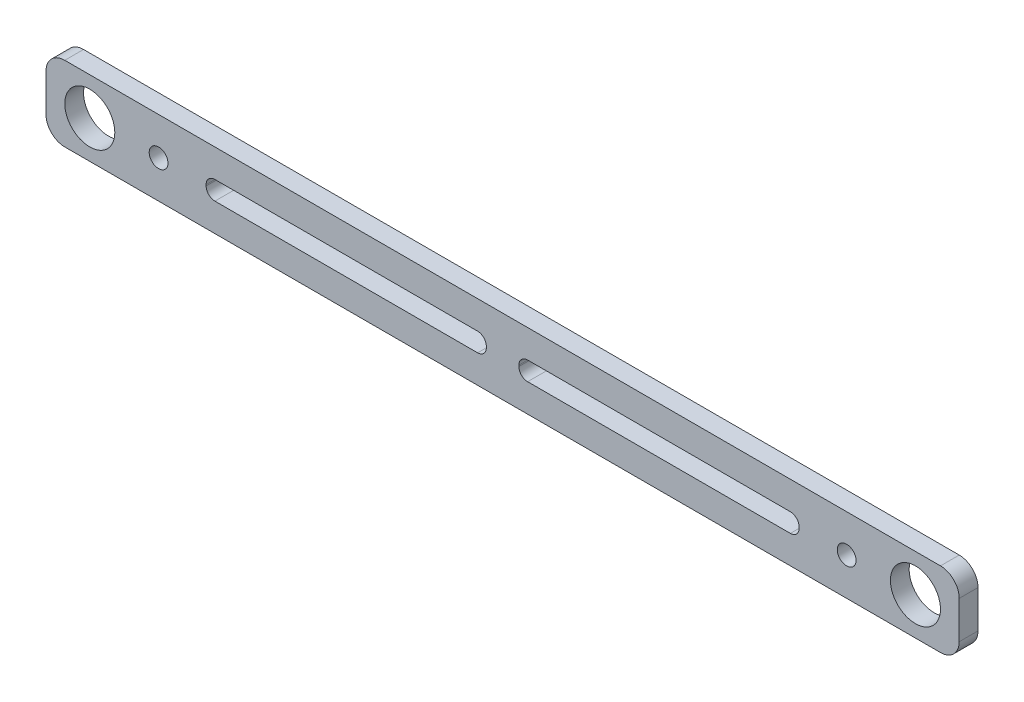
from build123d import *

# Parameters (mm, degrees)
SKETCH1_R           = 4
SKETCH1_R_2         = 1.5
BOSS_EXTRUDE1_DEPTH = 3


with BuildPart() as part:
    # Sketch1 → Boss-Extrude1 (new body)
    with BuildSketch(Plane.XY):
        with BuildLine():
            Line((-70, 6), (70, 6))
            ThreePointArc((70, 6), (72.121320344, 5.121320344), (73, 3))
            Line((73, 3), (73, -3))
            ThreePointArc((73, -3), (72.121320344, -5.121320344), (70, -6))
            Line((70, -6), (-70, -6))
            ThreePointArc((-70, -6), (-72.121320344, -5.121320344), (-73, -3))
            Line((-73, -3), (-73, 3))
            ThreePointArc((-73, 3), (-72.121320344, 5.121320344), (-70, 6))
        make_face()
        with Locations((-66, 0)):
            Circle(SKETCH1_R, mode=Mode.SUBTRACT)
        with Locations((66, 0)):
            Circle(SKETCH1_R, mode=Mode.SUBTRACT)
        with Locations((-55, 0)):
            Circle(SKETCH1_R_2, mode=Mode.SUBTRACT)
        with Locations((55, 0)):
            Circle(SKETCH1_R_2, mode=Mode.SUBTRACT)
        with BuildLine():
            Line((-46, 1.5), (-4, 1.5))
            ThreePointArc((-4, 1.5), (-3.010050506, 1.089949494), (-2.6, 0.1))
            Line((-2.6, 0.1), (-2.6, -0.1))
            ThreePointArc((-2.6, -0.1), (-3.010050506, -1.089949494), (-4, -1.5))
            Line((-4, -1.5), (-46, -1.5))
            ThreePointArc((-46, -1.5), (-46.989949494, -1.089949494), (-47.4, -0.1))
            Line((-47.4, -0.1), (-47.4, 0.1))
            ThreePointArc((-47.4, 0.1), (-46.989949494, 1.089949494), (-46, 1.5))
        make_face(mode=Mode.SUBTRACT)
        with BuildLine():
            Line((4, 1.5), (46, 1.5))
            ThreePointArc((46, 1.5), (46.989949494, 1.089949494), (47.4, 0.1))
            Line((47.4, 0.1), (47.4, -0.1))
            ThreePointArc((47.4, -0.1), (46.989949494, -1.089949494), (46, -1.5))
            Line((46, -1.5), (4, -1.5))
            ThreePointArc((4, -1.5), (3.010050506, -1.089949494), (2.6, -0.1))
            Line((2.6, -0.1), (2.6, 0.1))
            ThreePointArc((2.6, 0.1), (3.010050506, 1.089949494), (4, 1.5))
        make_face(mode=Mode.SUBTRACT)
    extrude(amount=BOSS_EXTRUDE1_DEPTH)


solid = part.part
